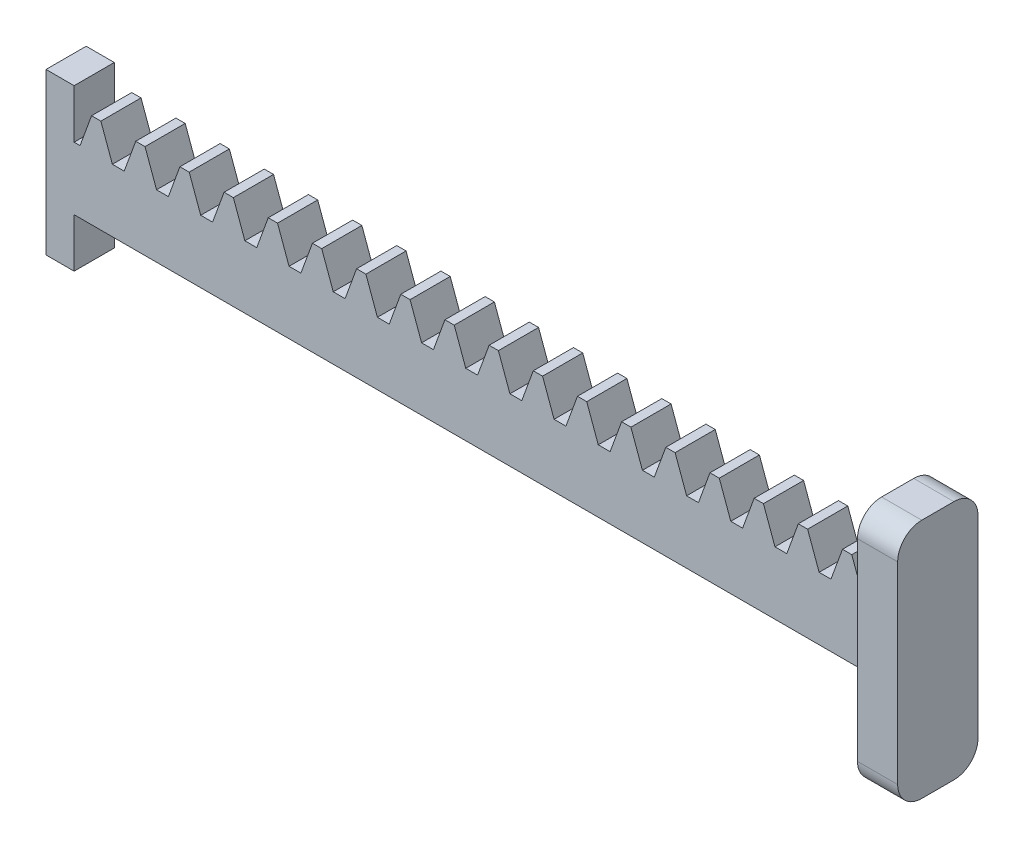
from build123d import *

# Parameters (mm, degrees)
BLANKSKE_W         = 100
BLANKSKE_H         = 11.75
BLANK_DEPTH        = 5
TOOTHCUTSIM_DEPTH  = 101.812015653
TEETHCUTS_COUNT    = 19
TEETHCUTS_PITCH    = 5.497787138
ESQUISSE1_W        = 3.5
ESQUISSE1_H        = 20
BOSS_EXTRU_1_DEPTH = 5
BOSS_EXTRU_2_DEPTH = 5


with BuildPart() as part:
    # BlankSke → Blank (new body)
    with BuildSketch(Plane.XY):
        with Locations((50, 5.875)):
            Rectangle(BLANKSKE_W, BLANKSKE_H)
    extrude(amount=-BLANK_DEPTH)

    # TooCutSkeSim → ToothCutSim (cut, through all)
    with BuildSketch(Plane.XY):
        Polygon((0.737261897, 7.8125), (-0.737261897, 7.8125), (-2.179639538, 11.7754), (2.179639538, 11.7754), align=None)
    toothcutsim = extrude(amount=-TOOTHCUTSIM_DEPTH, mode=Mode.SUBTRACT)

    # TeethCuts: ToothCutSim ×19
    with Locations(*[(i * TEETHCUTS_PITCH, 0, 0) for i in range(1, TEETHCUTS_COUNT)]):
        add(toothcutsim, mode=Mode.SUBTRACT)

    # Esquisse1 → Boss.-Extru.1 (add, through all)
    with BuildSketch(Plane(origin=(0, 0, -5), x_dir=(-1, 0, 0), z_dir=(0, 0, -1))):
        with Locations((1.75, 3.90625)):
            Rectangle(ESQUISSE1_W, ESQUISSE1_H)
    extrude(amount=-BOSS_EXTRU_1_DEPTH)

    # Esquisse4 → Boss.-Extru.2 (add)
    with BuildSketch(Plane(origin=(100, 0, 0), x_dir=(0, 0, -1), z_dir=(1, 0, 0))):
        with BuildLine():
            Line((0.5, -10.67809839), (4.5, -10.67809839))
            ThreePointArc((4.5, -10.67809839), (6.621320344, -9.799418733), (7.5, -7.67809839))
            Line((7.5, -7.67809839), (7.5, 16.32190161))
            ThreePointArc((7.5, 16.32190161), (6.621320344, 18.443221954), (4.5, 19.32190161))
            Line((4.5, 19.32190161), (0.5, 19.32190161))
            ThreePointArc((0.5, 19.32190161), (-1.621320344, 18.443221954), (-2.5, 16.32190161))
            Line((-2.5, 16.32190161), (-2.5, -7.67809839))
            ThreePointArc((-2.5, -7.67809839), (-1.621320344, -9.799418733), (0.5, -10.67809839))
        make_face()
    extrude(amount=BOSS_EXTRU_2_DEPTH)


solid = part.part
